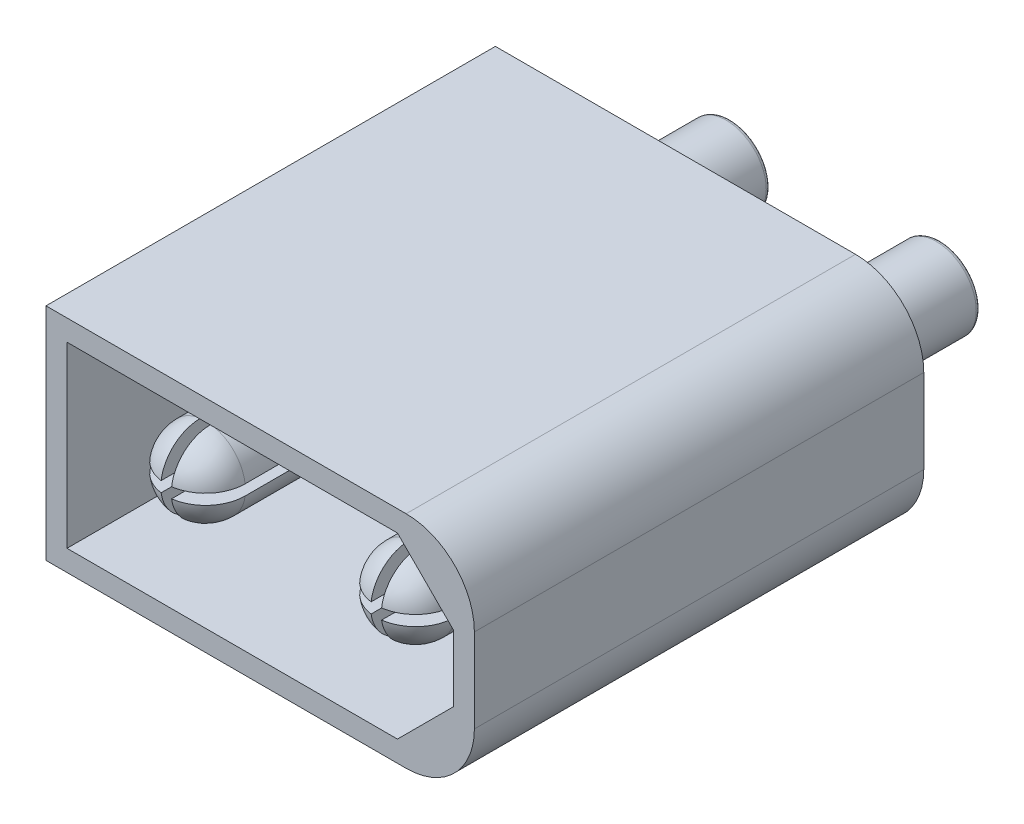
from build123d import *

# Parameters (mm, degrees)
BOSS_EXTRUDE1_DEPTH        = 10.7
BOSS_EXTRUDE5_DEPTH        = 9.5
BOSS_EXTRUDE5_DEPTH_BACK   = 3
SKETCH1_4_R                = 0.95
BOSS_EXTRUDE5_2_DEPTH      = 9.5
BOSS_EXTRUDE5_2_DEPTH_BACK = 3
BOSS_EXTRUDE3_DEPTH        = 2.5
DOME1_FACE_RADIUS          = 0.95
DOME1_HEIGHT               = 0.95
DOME2_FACE_RADIUS          = 0.95
DOME2_HEIGHT               = 0.95
CUT_EXTRUDE1_DEPTH         = 14.85390288
FILLET2_R                  = 0.1
FILLET3_R                  = 0.1


with BuildPart() as part:
    # Sketch1 → Boss-Extrude1 (new body)
    with BuildSketch(Plane.XY):
        with BuildLine():
            Line((0, -2.625), (0, 2.625))
            Line((0, 2.625), (8.575, 2.625))
            ThreePointArc((8.575, 2.625), (9.724048519, 2.149048519), (10.2, 1))
            Line((10.2, 1), (10.2, -1))
            ThreePointArc((10.2, -1), (9.724048519, -2.149048519), (8.575, -2.625))
            Line((8.575, -2.625), (0, -2.625))
        make_face()
        Polygon((0.5, -2.125), (8.367893219, -2.125), (9.7, -0.792893219), (9.7, 0.792893219), (8.367893219, 2.125), (0.5, 2.125), align=None, mode=Mode.SUBTRACT)
    extrude(amount=BOSS_EXTRUDE1_DEPTH)

    # Sketch3 → Boss-Extrude3 (add)
    with BuildSketch(Plane(origin=(0, 0, 1), x_dir=(-1, 0, 0), z_dir=(0, 0, -1))):
        Polygon((-0.5, -2.125), (-0.5, 2.125), (-8.367893219, 2.125), (-9.7, 0.792893219), (-9.7, -0.792893219), (-8.367893219, -2.125), align=None)
    extrude(amount=-BOSS_EXTRUDE3_DEPTH)


with BuildPart() as body_2:
    # Sketch1<4> → Boss-Extrude5 (new, two sides: drawn at the far end of the back side and taken through both)
    with BuildSketch(Plane.XY.offset(-BOSS_EXTRUDE5_DEPTH_BACK)):
        with Locations((2.6, 0)):
            Circle(SKETCH1_4_R)
    extrude(amount=BOSS_EXTRUDE5_DEPTH + BOSS_EXTRUDE5_DEPTH_BACK)

    # Dome2: a dome of height H over a round flat face of radius A is a cap of a sphere of radius (A * A + H * H) / (2 * H)
    dome2_r = (DOME2_FACE_RADIUS * DOME2_FACE_RADIUS + DOME2_HEIGHT * DOME2_HEIGHT) / (2 * DOME2_HEIGHT)
    dome2_base = Plane((2.6, 0, 9.5), z_dir=(0, 0, 1))
    with Locations(dome2_base.offset(DOME2_HEIGHT - dome2_r)):
        dome2_ball = Sphere(dome2_r, mode=Mode.PRIVATE)
    add(split(dome2_ball, bisect_by=dome2_base, keep=Keep.TOP, mode=Mode.PRIVATE))


with BuildPart() as body_3:
    # Sketch1<4> → Boss-Extrude5 2 (new, two sides: drawn at the far end of the back side and taken through both)
    with BuildSketch(Plane.XY.offset(-BOSS_EXTRUDE5_2_DEPTH_BACK)):
        with Locations(Location((7.6, 0, 0), (0, 0, 180))):
            Circle(SKETCH1_4_R)
    extrude(amount=BOSS_EXTRUDE5_2_DEPTH + BOSS_EXTRUDE5_2_DEPTH_BACK)

    # Dome1: a dome of height H over a round flat face of radius A is a cap of a sphere of radius (A * A + H * H) / (2 * H)
    dome1_r = (DOME1_FACE_RADIUS * DOME1_FACE_RADIUS + DOME1_HEIGHT * DOME1_HEIGHT) / (2 * DOME1_HEIGHT)
    dome1_base = Plane((7.6, 0, 9.5), z_dir=(0, 0, 1))
    with Locations(dome1_base.offset(DOME1_HEIGHT - dome1_r)):
        dome1_ball = Sphere(dome1_r, mode=Mode.PRIVATE)
    add(split(dome1_ball, bisect_by=dome1_base, keep=Keep.TOP, mode=Mode.PRIVATE))


with BuildPart() as cut_extrude1_tool:
    # Sketch4 → Cut-Extrude1 (new, through all)
    with BuildSketch(Plane.XY.offset(6)):
        with BuildLine():
            Line((7.475, 0.94174041), (7.475, 0.125))
            Line((7.475, 0.125), (6.65825959, 0.125))
            ThreePointArc((6.65825959, 0.125), (6.65, 0), (6.65825959, -0.125))
            Line((6.65825959, -0.125), (7.475, -0.125))
            Line((7.475, -0.125), (7.475, -0.94174041))
            ThreePointArc((7.475, -0.94174041), (7.6, -0.95), (7.725, -0.94174041))
            Line((7.725, -0.94174041), (7.725, -0.125))
            Line((7.725, -0.125), (8.54174041, -0.125))
            ThreePointArc((8.54174041, -0.125), (8.55, 0), (8.54174041, 0.125))
            Line((8.54174041, 0.125), (7.725, 0.125))
            Line((7.725, 0.125), (7.725, 0.94174041))
            ThreePointArc((7.725, 0.94174041), (7.6, 0.95), (7.475, 0.94174041))
        make_face()
        with BuildLine():
            Line((3.54174041, -0.125), (2.725, -0.125))
            Line((2.725, -0.125), (2.725, -0.94174041))
            ThreePointArc((2.725, -0.94174041), (2.6, -0.95), (2.475, -0.94174041))
            Line((2.475, -0.94174041), (2.475, -0.125))
            Line((2.475, -0.125), (1.65825959, -0.125))
            ThreePointArc((1.65825959, -0.125), (1.65, 0), (1.65825959, 0.125))
            Line((1.65825959, 0.125), (2.475, 0.125))
            Line((2.475, 0.125), (2.475, 0.94174041))
            ThreePointArc((2.475, 0.94174041), (2.6, 0.95), (2.725, 0.94174041))
            Line((2.725, 0.94174041), (2.725, 0.125))
            Line((2.725, 0.125), (3.54174041, 0.125))
            ThreePointArc((3.54174041, 0.125), (3.55, 0), (3.54174041, -0.125))
        make_face()
    extrude(amount=CUT_EXTRUDE1_DEPTH)


with BuildPart() as body_2_1:
    add(body_2.part)

    # Cut-Extrude1: cut by cut_extrude1_tool
    add(cut_extrude1_tool.part, mode=Mode.SUBTRACT)

    # Fillet3
    fillet3_edges = [body_2_1.edges().sort_by_distance(p)[0] for p in [
        (1.65, 0, -3),
    ]]
    fillet(fillet3_edges, radius=FILLET3_R)


with BuildPart() as body_3_1:
    add(body_3.part)

    # Cut-Extrude1: cut by cut_extrude1_tool
    add(cut_extrude1_tool.part, mode=Mode.SUBTRACT)

    # Fillet2
    fillet2_edges = [body_3_1.edges().sort_by_distance(p)[0] for p in [
        (8.55, 0, -3),
    ]]
    fillet(fillet2_edges, radius=FILLET2_R)


solid = Compound([part.part, body_2_1.part, body_3_1.part])
